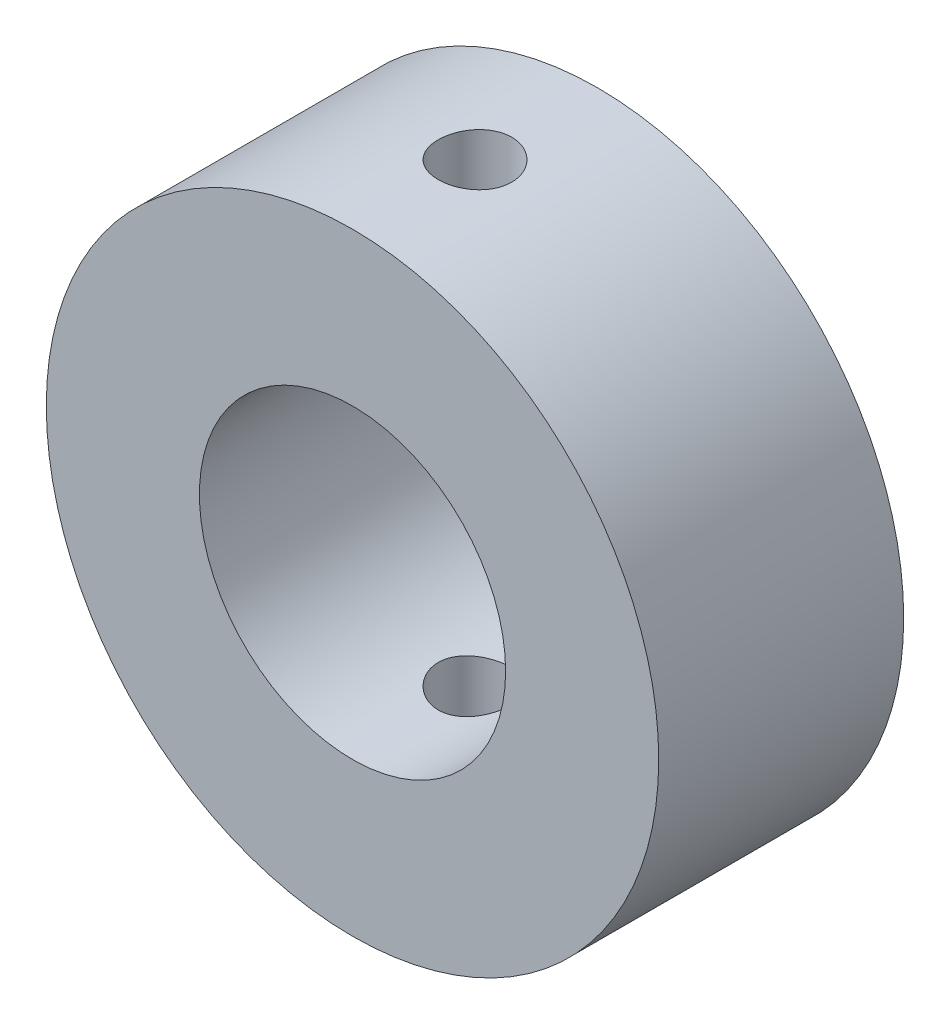
from build123d import *

# Parameters (mm, degrees)
SKETCH1_R               = 25
SKETCH1_R_2             = 12.5
BOSS_EXTRUDE1_DEPTH     = 20
CUT_EXTRUDE1_DEPTH      = 41.620192023
CUT_EXTRUDE1_DEPTH_BACK = 41.620192023
SKETCH2_R               = 3


with BuildPart() as part:
    # Sketch1 → Boss-Extrude1 (new body)
    with BuildSketch(Plane.XY):
        Circle(SKETCH1_R)
        Circle(SKETCH1_R_2, mode=Mode.SUBTRACT)
    extrude(amount=BOSS_EXTRUDE1_DEPTH)

    # Sketch2 → Cut-Extrude1 (cut, two sides: drawn at the far end of the back side and taken through both)
    with BuildSketch(Plane(origin=(0, 0, 0), x_dir=(1, 0, 0), z_dir=(0, 1, 0)).offset(-CUT_EXTRUDE1_DEPTH_BACK)):
        with Locations(Location((0, -10, 0), (0, 0, 270))):
            Circle(SKETCH2_R)
    extrude(amount=CUT_EXTRUDE1_DEPTH + CUT_EXTRUDE1_DEPTH_BACK, mode=Mode.SUBTRACT)


solid = part.part
